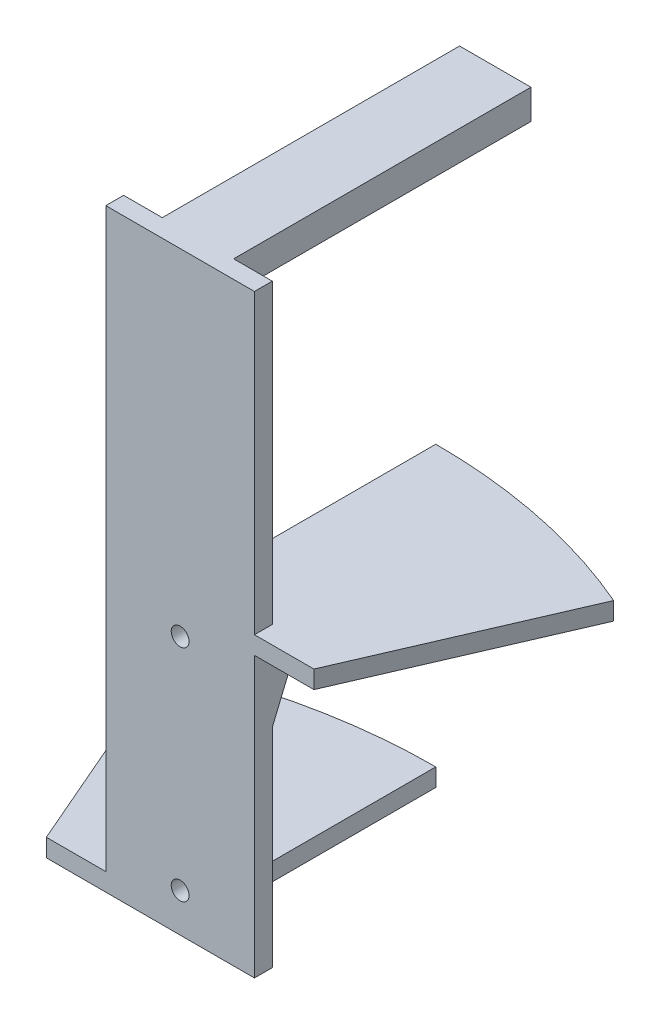
from build123d import *

# Parameters (mm, degrees)
SKETCH_1_W               = 25
SKETCH_1_H               = 50
SKETCH_1_R               = 1.5
EXTRUDE_1_DEPTH          = 3
EXTRUDE_START            = 22
EXTRUDE_2_DEPTH          = 3
CUT_EXTRUDE_1_DEPTH      = 3
CUT_EXTRUDE_2_DEPTH      = 3
RIB_1_REACH              = 70.903
SKETCH_7_WALL_W          = 152.805886826
SKETCH_7_WALL_H          = 3
PATTERN_CIRCULAR_1_COUNT = 2
SKETCH_8_W               = 25
SKETCH_8_H               = 3
EXTRUDE_3_DEPTH          = 50
SKETCH_9_W               = 12
SKETCH_9_H               = 5
EXTRUDE_4_DEPTH          = 50
SKETCH_10_W              = 3
SKETCH_10_H              = 45
EXTRUDE_5_DEPTH          = 3


with BuildPart() as part:
    # 草图1 → 凸台-拉伸1 (new body)
    with BuildSketch(Plane.XY):
        Rectangle(SKETCH_1_W, SKETCH_1_H)
        with Locations((0, 18.5)):
            Circle(SKETCH_1_R, mode=Mode.SUBTRACT)
        with Locations((0, -18.5)):
            Circle(SKETCH_1_R, mode=Mode.SUBTRACT)
    extrude(amount=EXTRUDE_1_DEPTH)

    # 草图4 → 凸台-拉伸2 (add)
    with BuildSketch(Plane(origin=(0, 0, 0), x_dir=(1, 0, 0), z_dir=(0, 1, 0)).offset(EXTRUDE_START)):
        with BuildLine():
            Line((-22.5, -3), (22.5, -3))
            Line((22.5, -3), (37.725646944, 32.188161826))
            ThreePointArc((37.725646944, 32.188161826), (0, 40), (-37.725646944, 32.188161826))
            Line((-37.725646944, 32.188161826), (-22.5, -3))
        make_face()
    extrude_2 = extrude(amount=EXTRUDE_2_DEPTH)

    # 镜向1: 凸台-拉伸2 across plane
    add(extrude_2.mirror(Plane.ZX))

    # 草图5 → 切除-拉伸1 (cut)
    with BuildSketch(Plane.XZ.offset(25)):
        Polygon((0, 0), (12.5, 0), (12.5, 3), (39.027541645, 3), (39.027541645, -43.548502894), (0, -43.548502894), align=None)
    extrude(amount=-CUT_EXTRUDE_1_DEPTH, mode=Mode.SUBTRACT)

    # 草图6 → 切除-拉伸2 (cut)
    with BuildSketch(Plane(origin=(0, 25, 0), x_dir=(1, 0, 0), z_dir=(0, 1, 0))):
        Polygon((0, 0), (-12.5, 0), (-12.5, -3), (-39.063803434, -3), (-39.063803434, 42.915846613), (0, 42.915846613), align=None)
    extrude(amount=-CUT_EXTRUDE_2_DEPTH, mode=Mode.SUBTRACT)

    # 草图7 wall → 筋1 (add, up to next)
    with BuildSketch(Plane(origin=(-12.5, -16, -2.5), x_dir=(0, 0.923076923077, 0.384615384615), z_dir=(0, 0.384615384615, -0.923076923077)), mode=Mode.PRIVATE) as rib_1_sk1:
        with Locations((0, 1.5)):
            Rectangle(SKETCH_7_WALL_W, SKETCH_7_WALL_H)
    rib_1_tool1 = extrude(rib_1_sk1.sketch, amount=-RIB_1_REACH, mode=Mode.PRIVATE) - part.part
    rib_1 = rib_1_tool1.solids().sort_by_distance((-12.5, -16, -2.5))[0]
    add(rib_1)

    # 阵列(圆周)1: 筋1 ×2 about axis
    pattern_circular_1_axis = Axis((0, 0, -26.4), (0, 0, 1))
    for i in range(1, PATTERN_CIRCULAR_1_COUNT):
        add(rib_1.rotate(pattern_circular_1_axis, i * 360 / PATTERN_CIRCULAR_1_COUNT))

    # 草图8 → 凸台-拉伸3 (add)
    with BuildSketch(Plane(origin=(0, 25, 0), x_dir=(1, 0, 0), z_dir=(0, 1, 0))):
        with Locations((0, -1.5)):
            Rectangle(SKETCH_8_W, SKETCH_8_H)
    extrude(amount=EXTRUDE_3_DEPTH)

    # 草图9 → 凸台-拉伸4 (add)
    with BuildSketch(Plane(origin=(0, 0, 0), x_dir=(-1, 0, 0), z_dir=(0, 0, -1))):
        with Locations((0, 72.5)):
            Rectangle(SKETCH_9_W, SKETCH_9_H)
    extrude(amount=EXTRUDE_4_DEPTH)

    # 草图10 → 凸台-拉伸5 (add)
    with BuildSketch(Plane(origin=(0, 0, 0), x_dir=(-1, 0, 0), z_dir=(0, 0, -1))):
        with Locations((-4.5, 47.5)):
            Rectangle(SKETCH_10_W, SKETCH_10_H)
        with Locations((4.5, 47.5)):
            Rectangle(SKETCH_10_W, SKETCH_10_H)
    extrude(amount=EXTRUDE_5_DEPTH)


solid = part.part
